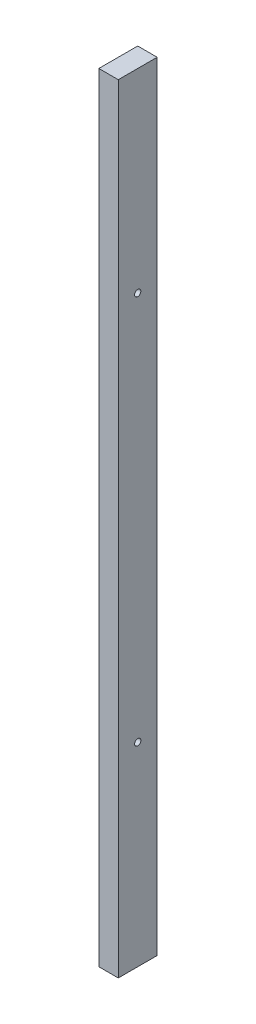
from build123d import *

# Parameters (mm, degrees)
SKETCH_1_W          = 25
SKETCH_1_H          = 50
EXTRUDE_1_DEPTH     = 1000
SKETCH_2_R          = 4
CUT_EXTRUDE_1_DEPTH = 2214.15898255


with BuildPart() as part:
    # Эскиз1 → Бобышка-Вытянуть1 (new body)
    with BuildSketch(Plane(origin=(0, 0, 0), x_dir=(1, 0, 0), z_dir=(0, 1, 0))):
        Rectangle(SKETCH_1_W, SKETCH_1_H)
    extrude(amount=EXTRUDE_1_DEPTH)

    # Эскиз2 → Вырез-Вытянуть1 (cut)
    with BuildSketch(Plane(origin=(12.5, 0, 0), x_dir=(0, 0, -1), z_dir=(1, 0, 0))):
        with Locations((0, 250)):
            Circle(SKETCH_2_R)
        with Locations((0, 750)):
            Circle(SKETCH_2_R)
    extrude(amount=-CUT_EXTRUDE_1_DEPTH, mode=Mode.SUBTRACT)


solid = part.part
